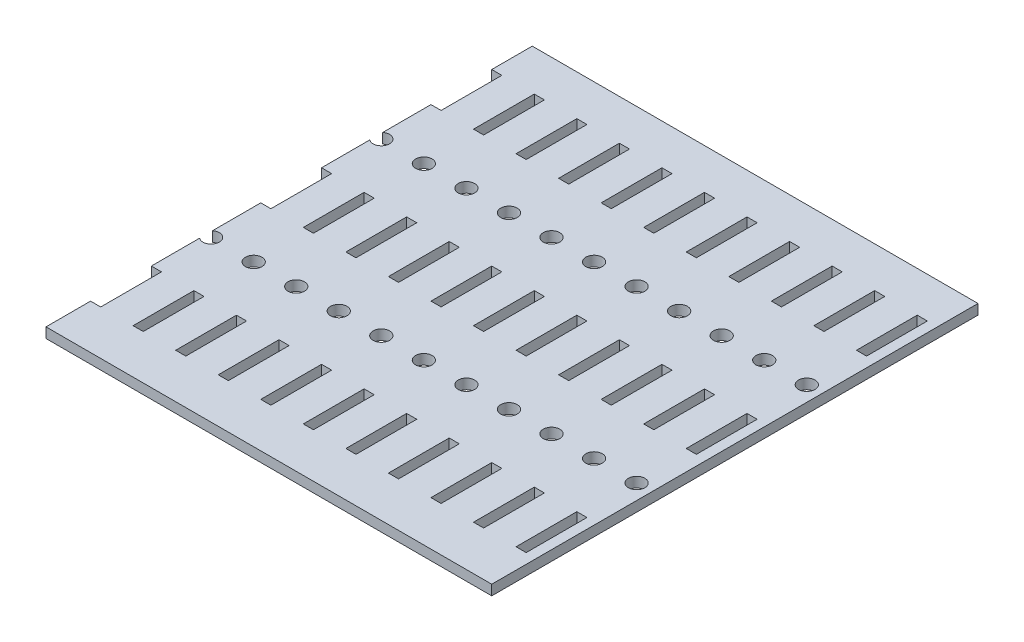
from build123d import *

# Parameters (mm, degrees)
SKETCH1_W                        = 139.7
SKETCH1_H                        = 152.4
BOSS_EXTRUDE1_DEPTH              = 3.175
SKETCH2_W                        = 3.175
SKETCH2_H                        = 19.05
CUT_EXTRUDE1_DEPTH               = 117.217805292
LPATTERN1_COUNT                  = 11
LPATTERN1_PITCH                  = 13.335
F_13_64_0_20313_DIAMETER_HOLE1_D = 5.159502
LPATTERN2_COUNT                  = 2
LPATTERN2_PITCH                  = 53.34


with BuildPart() as part:
    # Sketch1 → Boss-Extrude1 (new body)
    with BuildSketch(Plane(origin=(0, 0, 0), x_dir=(1, 0, 0), z_dir=(0, 1, 0))):
        with Locations((-9.926173285, 8.252707581)):
            Rectangle(SKETCH1_W, SKETCH1_H)
    extrude(amount=BOSS_EXTRUDE1_DEPTH)

    # Sketch2 → Cut-Extrude1 (cut, through all)
    with BuildSketch(Plane(origin=(0, 3.175, 0), x_dir=(1, 0, 0), z_dir=(0, 1, 0))):
        with Locations((-78.188673285, 62.227707581)):
            Rectangle(SKETCH2_W, SKETCH2_H)
        with Locations((-78.188673285, 8.887707581)):
            Rectangle(SKETCH2_W, SKETCH2_H)
        with Locations((-78.188673285, -44.452292419)):
            Rectangle(SKETCH2_W, SKETCH2_H)
    cut_extrude1 = extrude(amount=-CUT_EXTRUDE1_DEPTH, mode=Mode.SUBTRACT)

    # LPattern1: Cut-Extrude1 ×11
    with Locations(*[(i * LPATTERN1_PITCH, 0, 0) for i in range(1, LPATTERN1_COUNT)]):
        add(cut_extrude1, mode=Mode.SUBTRACT)

    # 13/64 (0.20313) Diameter Hole1 (through all)
    with Locations(Plane(origin=(0, 3.175, 0), x_dir=(1, 0, 0), z_dir=(0, 1, 0))):
        with Locations((55.161326715, -17.782292419), (41.826326715, -17.782292419), (28.491326715, -17.782292419), (15.156326715, -17.782292419), (1.821326715, -17.782292419), (-11.513673285, -17.782292419), (-24.848673285, -17.782292419), (-38.183673285, -17.782292419), (-51.518673285, -17.782292419), (-64.853673285, -17.782292419), (-78.188673285, -17.782292419), (-91.523673285, -17.782292419), (-104.858673285, -17.782292419), (-118.193673285, -17.782292419), (-131.528673285, -17.782292419)):
            f_13_64_0_20313_diameter_hole1 = Hole(F_13_64_0_20313_DIAMETER_HOLE1_D / 2)

    # LPattern2: 13/64 (0.20313) Diameter Hole1 ×2
    with Locations(*[(0, 0, -i * LPATTERN2_PITCH) for i in range(1, LPATTERN2_COUNT)]):
        add(f_13_64_0_20313_diameter_hole1, mode=Mode.SUBTRACT)


solid = part.part
